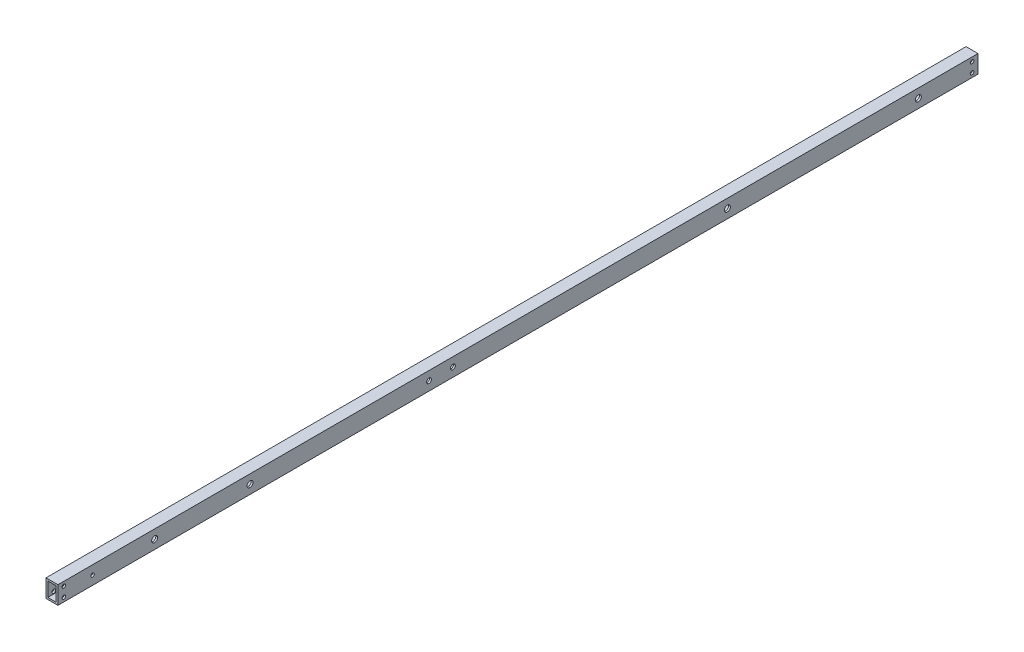
from build123d import *

# Parameters (mm, degrees)
SKETCH_1_W          = 10
SKETCH_1_H          = 15
SKETCH_1_W_2        = 7
SKETCH_1_H_2        = 12
EXTRUDE_1_DEPTH     = 771
SKETCH_2_R          = 1.5
SKETCH_2_R_2        = 2.5
SKETCH_2_R_3        = 2
CUT_EXTRUDE_1_DEPTH = 772.101322784
SKETCH_3_R          = 4
CUT_EXTRUDE_2_DEPTH = 1.5


with BuildPart() as part:
    # ｽｹｯﾁ1 → 押し出し-薄板1 (new body)
    with BuildSketch(Plane.XY):
        Rectangle(SKETCH_1_W, SKETCH_1_H)
        Rectangle(SKETCH_1_W_2, SKETCH_1_H_2, mode=Mode.SUBTRACT)
    extrude(amount=EXTRUDE_1_DEPTH)

    # ｽｹｯﾁ2 → ｶｯﾄ - 押し出し1 (cut, through all)
    with BuildSketch(Plane(origin=(5, 0, 0), x_dir=(0, 0, -1), z_dir=(1, 0, 0))):
        with Locations((-5, 4)):
            Circle(SKETCH_2_R)
        with Locations((-5, -4)):
            Circle(SKETCH_2_R)
        with Locations((-766, 4)):
            Circle(SKETCH_2_R)
        with Locations((-766, -4)):
            Circle(SKETCH_2_R)
        with Locations((-50, 0)):
            Circle(SKETCH_2_R_2)
        with Locations((-742, 0)):
            Circle(SKETCH_2_R)
        with Locations((-690, 0)):
            Circle(SKETCH_2_R_2)
        with Locations((-440, 0)):
            Circle(SKETCH_2_R_3)
        with Locations((-460, 0)):
            Circle(SKETCH_2_R_3)
        with Locations((-610, 0)):
            Circle(SKETCH_2_R_2)
        with Locations((-210, 0)):
            Circle(SKETCH_2_R_2)
    extrude(amount=-CUT_EXTRUDE_1_DEPTH, mode=Mode.SUBTRACT)

    # ｽｹｯﾁ3 → ｶｯﾄ - 押し出し2 (cut)
    with BuildSketch(Plane.ZY.offset(5)):
        with Locations((440, 0)):
            Circle(SKETCH_3_R)
        with Locations((460, 0)):
            Circle(SKETCH_3_R)
    extrude(amount=-CUT_EXTRUDE_2_DEPTH, mode=Mode.SUBTRACT)


solid = part.part
